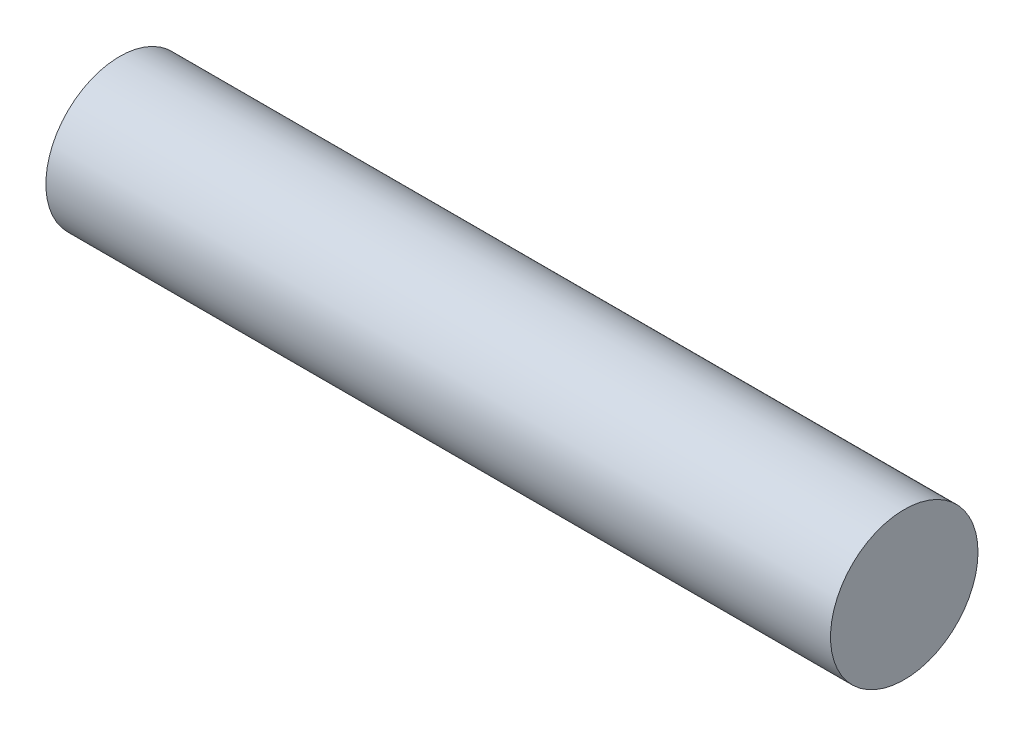
from build123d import *

# Parameters (mm, degrees)
SKETCH1_R           = 2.5
BOSS_EXTRUDE1_DEPTH = 26.6


with BuildPart() as part:
    # Sketch1 → Boss-Extrude1 (new body)
    with BuildSketch(Plane(origin=(0, 0, 0), x_dir=(0, 0, -1), z_dir=(1, 0, 0))):
        Circle(SKETCH1_R)
    extrude(amount=BOSS_EXTRUDE1_DEPTH)


solid = part.part
